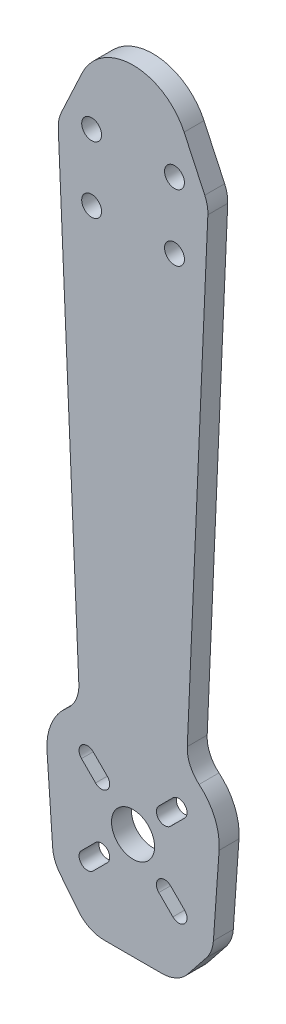
from build123d import *

# Parameters (mm, degrees)
SKETCH1_R           = 3.25
SKETCH1_R_2         = 1.5
BOSS_EXTRUDE1_DEPTH = 3


with BuildPart() as part:
    # Sketch1 → Boss-Extrude1 (new body)
    with BuildSketch(Plane(origin=(0, 0, 0), x_dir=(-1, 0, 0), z_dir=(0, 0, -1))):
        with BuildLine():
            Line((8.181538342, 15.560412846), (11.282357346, 86.580844321))
            ThreePointArc((11.282357346, 86.580844321), (11.19104264, 87.774392868), (10.818655174, 88.912032567))
            Line((10.818655174, 88.912032567), (7.70361619, 95.592255225))
            ThreePointArc((7.70361619, 95.592255225), (0, 100.5), (-7.70361619, 95.592255225))
            Line((-7.70361619, 95.592255225), (-10.818655174, 88.912032567))
            ThreePointArc((-10.818655174, 88.912032567), (-11.19104264, 87.774392868), (-11.282357346, 86.580844321))
            Line((-11.282357346, 86.580844321), (-8.181538342, 15.560412846))
            ThreePointArc((-8.181538342, 15.560412846), (-8.600305132, 13.328393664), (-9.963157432, 11.511828536))
            ThreePointArc((-9.963157432, 11.511828536), (-12.324154236, 8.321537367), (-12.979294427, 4.407069973))
            Line((-12.979294427, 4.407069973), (-12.122281745, -7.848782369))
            ThreePointArc((-12.122281745, -7.848782369), (-11.79450084, -9.312190191), (-11.047502278, -10.612573183))
            Line((-11.047502278, -10.612573183), (-8.26347657, -14.112573183))
            ThreePointArc((-8.26347657, -14.112573183), (-6.522662073, -15.503491197), (-4.350435786, -16))
            Line((-4.350435786, -16), (4.350435786, -16))
            ThreePointArc((4.350435786, -16), (6.522662073, -15.503491197), (8.26347657, -14.112573183))
            Line((8.26347657, -14.112573183), (11.047502278, -10.612573183))
            ThreePointArc((11.047502278, -10.612573183), (11.79450084, -9.312190191), (12.122281745, -7.848782369))
            Line((12.122281745, -7.848782369), (12.979294427, 4.407069973))
            ThreePointArc((12.979294427, 4.407069973), (12.324154236, 8.321537367), (9.963157432, 11.511828536))
            ThreePointArc((9.963157432, 11.511828536), (8.600305132, 13.328393664), (8.181538342, 15.560412846))
        make_face()
        with Locations(Location((0, 0, 0), (0, 0, 180))):
            Circle(SKETCH1_R, mode=Mode.SUBTRACT)
        with Locations(Location((6.25, 89, 0), (0, 0, 180))):
            Circle(SKETCH1_R_2, mode=Mode.SUBTRACT)
        with Locations(Location((6.25, 79, 0), (0, 0, 180))):
            Circle(SKETCH1_R_2, mode=Mode.SUBTRACT)
        with Locations(Location((-6.25, 89, 0), (0, 0, 180))):
            Circle(SKETCH1_R_2, mode=Mode.SUBTRACT)
        with Locations(Location((-6.25, 79, 0), (0, 0, 180))):
            Circle(SKETCH1_R_2, mode=Mode.SUBTRACT)
        with BuildLine():
            Line((7.778174593, 6.01040764), (5.656854249, 3.889087297))
            ThreePointArc((5.656854249, 3.889087297), (3.889087297, 3.889087297), (3.889087297, 5.656854249))
            Line((3.889087297, 5.656854249), (6.01040764, 7.778174593))
            ThreePointArc((6.01040764, 7.778174593), (7.778174593, 7.778174593), (7.778174593, 6.01040764))
        make_face(mode=Mode.SUBTRACT)
        with BuildLine():
            Line((-5.656854249, 3.889087297), (-7.778174593, 6.01040764))
            ThreePointArc((-7.778174593, 6.01040764), (-7.778174593, 7.778174593), (-6.01040764, 7.778174593))
            Line((-6.01040764, 7.778174593), (-3.889087297, 5.656854249))
            ThreePointArc((-3.889087297, 5.656854249), (-3.889087297, 3.889087297), (-5.656854249, 3.889087297))
        make_face(mode=Mode.SUBTRACT)
        with BuildLine():
            Line((-3.889087297, -5.656854249), (-6.01040764, -7.778174593))
            ThreePointArc((-6.01040764, -7.778174593), (-7.778174593, -7.778174593), (-7.778174593, -6.01040764))
            Line((-7.778174593, -6.01040764), (-5.656854249, -3.889087297))
            ThreePointArc((-5.656854249, -3.889087297), (-3.889087297, -3.889087297), (-3.889087297, -5.656854249))
        make_face(mode=Mode.SUBTRACT)
        with BuildLine():
            Line((6.01040764, -7.778174593), (3.889087297, -5.656854249))
            ThreePointArc((3.889087297, -5.656854249), (3.889087297, -3.889087297), (5.656854249, -3.889087297))
            Line((5.656854249, -3.889087297), (7.778174593, -6.01040764))
            ThreePointArc((7.778174593, -6.01040764), (7.778174593, -7.778174593), (6.01040764, -7.778174593))
        make_face(mode=Mode.SUBTRACT)
    extrude(amount=-BOSS_EXTRUDE1_DEPTH)


solid = part.part
